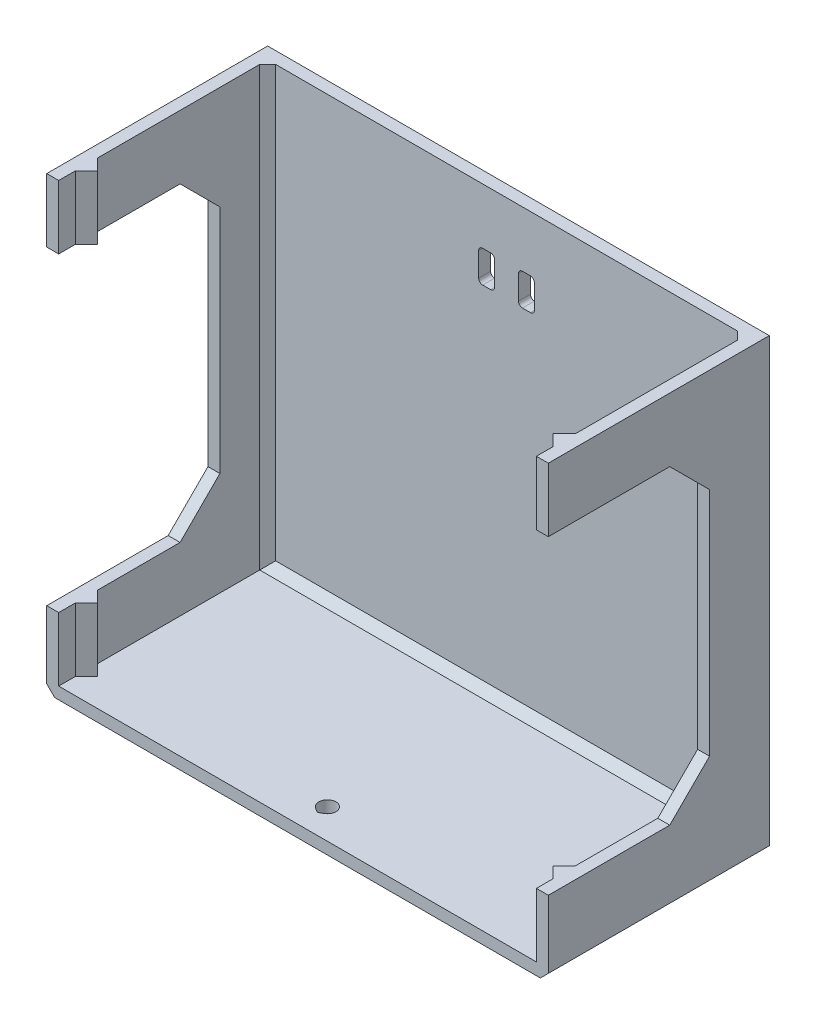
from build123d import *

# Parameters (mm, degrees)
SKETCH1_W           = 126
SKETCH1_H           = 110
BOSS_EXTRUDE1_DEPTH = 3
SKETCH2_W           = 50
SKETCH2_H           = 16
BOSS_EXTRUDE2_DEPTH = 3
BOSS_EXTRUDE3_DEPTH = 16
BOSS_EXTRUDE4_DEPTH = 16
SKETCH5_W           = 126
SKETCH5_H           = 53
BOSS_EXTRUDE5_DEPTH = 3
SKETCH7_W           = 3
SKETCH7_H           = 78
BOSS_EXTRUDE6_DEPTH = 12
SKETCH8_R           = 2.15
CUT_EXTRUDE1_DEPTH  = 140.810586151
CUT_EXTRUDE2_DEPTH  = 140.810586151
CUT_EXTRUDE3_DEPTH  = 138.397234324
SKETCH11_W          = 3
SKETCH11_H          = 16
BOSS_EXTRUDE7_DEPTH = 2.5
CHAMFER1_SIZE       = 10
CHAMFER2_SIZE       = 2
SKETCH12_W          = 4
SKETCH12_H          = 8
CUT_EXTRUDE4_DEPTH  = 101.445258723
FILLET1_R           = 1
CHAMFER3_SIZE       = 2


with BuildPart() as part:
    # Sketch1 → Boss-Extrude1 (new body)
    with BuildSketch(Plane.XY):
        Rectangle(SKETCH1_W, SKETCH1_H)
    extrude(amount=BOSS_EXTRUDE1_DEPTH)

    # Sketch2 → Boss-Extrude2 (add)
    with BuildSketch(Plane.ZY.offset(63)):
        with Locations((28, 47)):
            Rectangle(SKETCH2_W, SKETCH2_H)
        with Locations((28, -47)):
            Rectangle(SKETCH2_W, SKETCH2_H)
    boss_extrude2 = extrude(amount=-BOSS_EXTRUDE2_DEPTH)

    # Sketch3 → Boss-Extrude3 (add)
    with BuildSketch(Plane.XZ.offset(55)):
        Polygon((-60, 45.5), (-57, 48.5), (-60, 51.5), align=None)
    boss_extrude3 = extrude(amount=-BOSS_EXTRUDE3_DEPTH)

    # Sketch4 → Boss-Extrude4 (add)
    with BuildSketch(Plane(origin=(0, 55, 0), x_dir=(1, 0, 0), z_dir=(0, 1, 0))):
        Polygon((-60, -51.5), (-57, -48.5), (-60, -45.5), align=None)
    boss_extrude4 = extrude(amount=-BOSS_EXTRUDE4_DEPTH)

    # Mirror1: Boss-Extrude2, Boss-Extrude3, Boss-Extrude4 across plane
    add(boss_extrude2.mirror(Plane(origin=(0, 0, 0), x_dir=(0, 0, 1), z_dir=(1, 0, 0))))
    add(boss_extrude3.mirror(Plane(origin=(0, 0, 0), x_dir=(0, 0, 1), z_dir=(1, 0, 0))))
    add(boss_extrude4.mirror(Plane(origin=(0, 0, 0), x_dir=(0, 0, 1), z_dir=(1, 0, 0))))

    # Sketch5 → Boss-Extrude5 (add)
    with BuildSketch(Plane.XZ.offset(55)):
        with Locations((0, 26.5)):
            Rectangle(SKETCH5_W, SKETCH5_H)
    extrude(amount=BOSS_EXTRUDE5_DEPTH)

    # Sketch7 → Boss-Extrude6 (add)
    with BuildSketch(Plane.XY.offset(3)):
        with Locations((-61.5, 0)):
            Rectangle(SKETCH7_W, SKETCH7_H)
        with Locations((61.5, 0)):
            Rectangle(SKETCH7_W, SKETCH7_H)
    extrude(amount=BOSS_EXTRUDE6_DEPTH)

    # Sketch8 → Cut-Extrude1 (cut, through all)
    with BuildSketch(Plane.XZ.offset(58)):
        with Locations(Location((0, 48, 0), (0, 0, 270))):
            Circle(SKETCH8_R)
    extrude(amount=-CUT_EXTRUDE1_DEPTH, mode=Mode.SUBTRACT)

    # Sketch9 → Cut-Extrude2 (cut, through all)
    with BuildSketch(Plane.XZ.offset(58)):
        Polygon((-1.075, 49.861954618), (0, 50.482606158), (1.075, 49.861954618), align=None)
    extrude(amount=-CUT_EXTRUDE2_DEPTH, mode=Mode.SUBTRACT)

    # Sketch10 → Cut-Extrude3 (cut, through all)
    with BuildSketch(Plane(origin=(0, -55, 0), x_dir=(1, 0, 0), z_dir=(0, 1, 0))):
        Polygon((-60, -45.5), (-60, -45.7), (-57.2, -48.5), (-60, -51.3), (-60, -51.5), (-57, -48.5), align=None)
        Polygon((60, -45.7), (57.2, -48.5), (60, -51.3), (60, -51.5), (57, -48.5), (60, -45.5), align=None)
    extrude(amount=CUT_EXTRUDE3_DEPTH, mode=Mode.SUBTRACT)

    # Sketch11 → Boss-Extrude7 (add)
    with BuildSketch(Plane.XY.offset(53)):
        Polygon((-63, -39), (-63, -58), (63, -58), (63, -39), (60, -39), (60, -55), (-60, -55), (-60, -39), align=None)
        with Locations((-61.5, 47)):
            Rectangle(SKETCH11_W, SKETCH11_H)
        with Locations((61.5, 47)):
            Rectangle(SKETCH11_W, SKETCH11_H)
    extrude(amount=BOSS_EXTRUDE7_DEPTH)

    # Chamfer1
    chamfer1_edges = [part.edges().sort_by_distance(p)[0] for p in [
        (-61.5, -39, 15),
        (-61.5, 39, 15),
        (61.5, 39, 15),
        (61.5, -39, 15),
    ]]
    chamfer(chamfer1_edges, length=CHAMFER1_SIZE)

    # Chamfer2
    chamfer2_edges = [part.edges().sort_by_distance(p)[0] for p in [
        (-60, 0, 3),
        (0, -55, 3),
        (60, 0, 3),
    ]]
    chamfer(chamfer2_edges, length=CHAMFER2_SIZE)

    # Sketch12 → Cut-Extrude4 (cut, through all)
    with BuildSketch(Plane.XY.offset(3)):
        with Locations((-5, 37)):
            Rectangle(SKETCH12_W, SKETCH12_H)
        with Locations((5, 37)):
            Rectangle(SKETCH12_W, SKETCH12_H)
    extrude(amount=-CUT_EXTRUDE4_DEPTH, mode=Mode.SUBTRACT)

    # Fillet1
    fillet1_edges = [part.edges().sort_by_distance(p)[0] for p in [
        (-7, 33, 1.5),
        (-7, 41, 1.5),
        (-3, 41, 1.5),
        (-3, 33, 1.5),
        (3, 33, 1.5),
        (3, 41, 1.5),
        (7, 41, 1.5),
        (7, 33, 1.5),
    ]]
    fillet(fillet1_edges, radius=FILLET1_R)

    # Chamfer3
    chamfer3_edges = [part.edges().sort_by_distance(p)[0] for p in [
        (-63, -58, 27.75),
        (63, -58, 27.75),
    ]]
    chamfer(chamfer3_edges, length=CHAMFER3_SIZE)


solid = part.part
